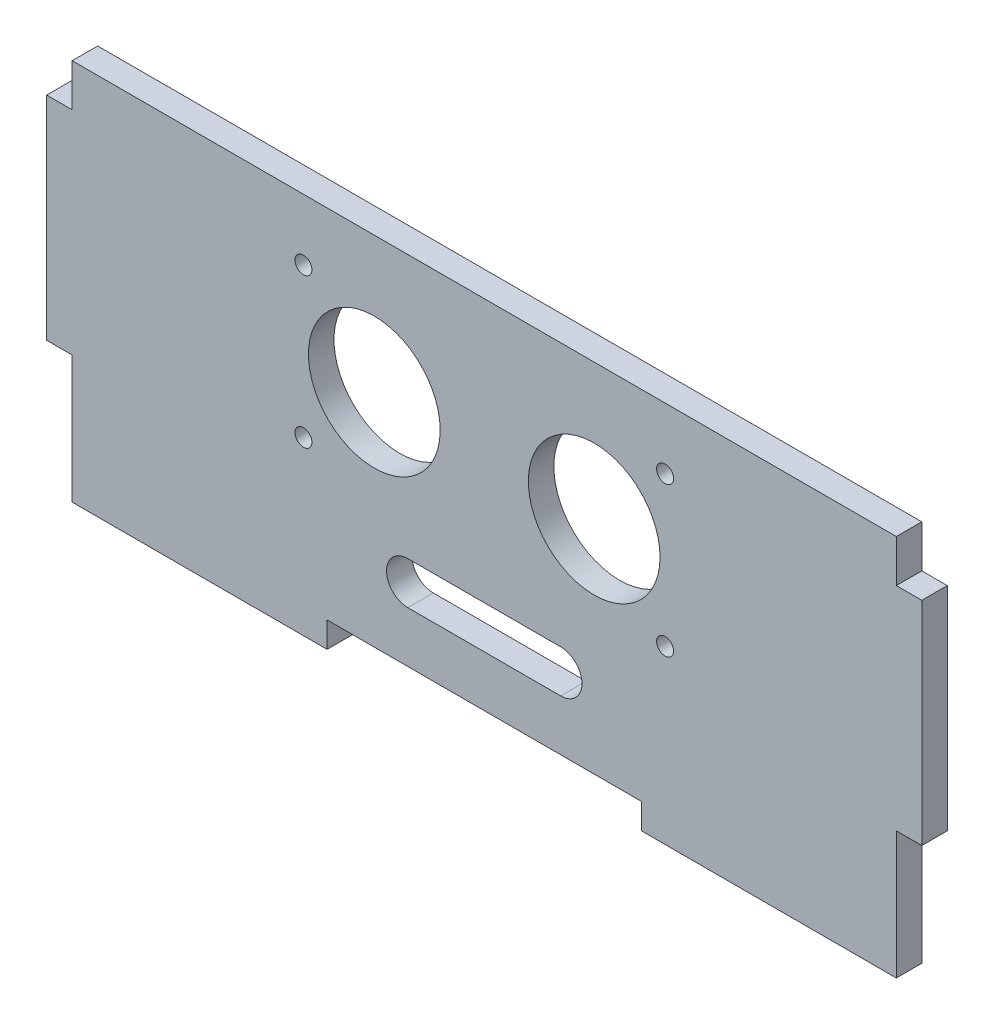
from build123d import *

# Parameters (mm, degrees)
ESBO_O1_W                = 103
ESBO_O1_H                = 55
RESSALTO_EXTRUS_O1_DEPTH = 3
ESBO_O2_W                = 3
ESBO_O2_H                = 15
CORTE_EXTRUS_O1_DEPTH    = 59.459387612
ESBO_O3_W                = 37
ESBO_O3_H                = 3
CORTE_EXTRUS_O2_DEPTH    = 59.459387612
ESBO_O4_W                = 97
ESBO_O4_H                = 10
CORTE_EXTRUS_O3_DEPTH    = 10
ESBO_O5_R                = 7.75
CORTE_EXTRUS_O4_DEPTH    = 59.459387612
CORTE_EXTRUS_O5_DEPTH    = 59.459387612
ESBO_O10_R               = 1
CORTE_EXTRUS_O6_DEPTH    = 59.459387612


with BuildPart() as part:
    # Esboço1 → Ressalto-extrusão1 (new body)
    with BuildSketch(Plane.XY):
        Rectangle(ESBO_O1_W, ESBO_O1_H)
    extrude(amount=RESSALTO_EXTRUS_O1_DEPTH)

    # Esboço2 → Corte-extrusão1 (cut, through all)
    with BuildSketch(Plane(origin=(0, 0, 0), x_dir=(-1, 0, 0), z_dir=(0, 0, -1))):
        with Locations((-50, 20)):
            Rectangle(ESBO_O2_W, ESBO_O2_H)
        with Locations((-50, -20)):
            Rectangle(ESBO_O2_W, ESBO_O2_H)
        with Locations((50, 20)):
            Rectangle(ESBO_O2_W, ESBO_O2_H)
        with Locations((50, -20)):
            Rectangle(ESBO_O2_W, ESBO_O2_H)
    extrude(amount=-CORTE_EXTRUS_O1_DEPTH, mode=Mode.SUBTRACT)

    # Esboço3 → Corte-extrusão2 (cut, through all)
    with BuildSketch(Plane(origin=(0, 0, 0), x_dir=(-1, 0, 0), z_dir=(0, 0, -1))):
        with Locations((0, -26)):
            Rectangle(ESBO_O3_W, ESBO_O3_H)
    extrude(amount=-CORTE_EXTRUS_O2_DEPTH, mode=Mode.SUBTRACT)

    # Esboço4 → Corte-extrusão3 (cut)
    with BuildSketch(Plane(origin=(0, 0, 0), x_dir=(-1, 0, 0), z_dir=(0, 0, -1))):
        with Locations((0, 22.5)):
            Rectangle(ESBO_O4_W, ESBO_O4_H)
    extrude(amount=-CORTE_EXTRUS_O3_DEPTH, mode=Mode.SUBTRACT)

    # Esboço5 → Corte-extrusão4 (cut, through all)
    with BuildSketch(Plane.XY.offset(3)):
        with Locations((-12.94, 1.5)):
            Circle(ESBO_O5_R)
        with Locations((12.94, 1.5)):
            Circle(ESBO_O5_R)
    extrude(amount=-CORTE_EXTRUS_O4_DEPTH, mode=Mode.SUBTRACT)

    # Esboço6 → Corte-extrusão5 (cut, through all)
    with BuildSketch(Plane(origin=(0, 0, 0), x_dir=(-1, 0, 0), z_dir=(0, 0, -1))):
        with BuildLine():
            Line((-9, -18.5), (9, -18.5))
            ThreePointArc((9, -18.5), (11.5, -16), (9, -13.5))
            Line((9, -13.5), (-9, -13.5))
            ThreePointArc((-9, -13.5), (-11.5, -16), (-9, -18.5))
        make_face()
    extrude(amount=-CORTE_EXTRUS_O5_DEPTH, mode=Mode.SUBTRACT)

    # Esboço10 → Corte-extrusão6 (cut, through all)
    with BuildSketch(Plane(origin=(0, 0, 0), x_dir=(-1, 0, 0), z_dir=(0, 0, -1))):
        with Locations((-21.285, 10.29)):
            Circle(ESBO_O10_R)
        with Locations((-21.285, -7.29)):
            Circle(ESBO_O10_R)
        with Locations((21.285, -7.29)):
            Circle(ESBO_O10_R)
        with Locations((21.285, 10.29)):
            Circle(ESBO_O10_R)
    extrude(amount=-CORTE_EXTRUS_O6_DEPTH, mode=Mode.SUBTRACT)


solid = part.part
